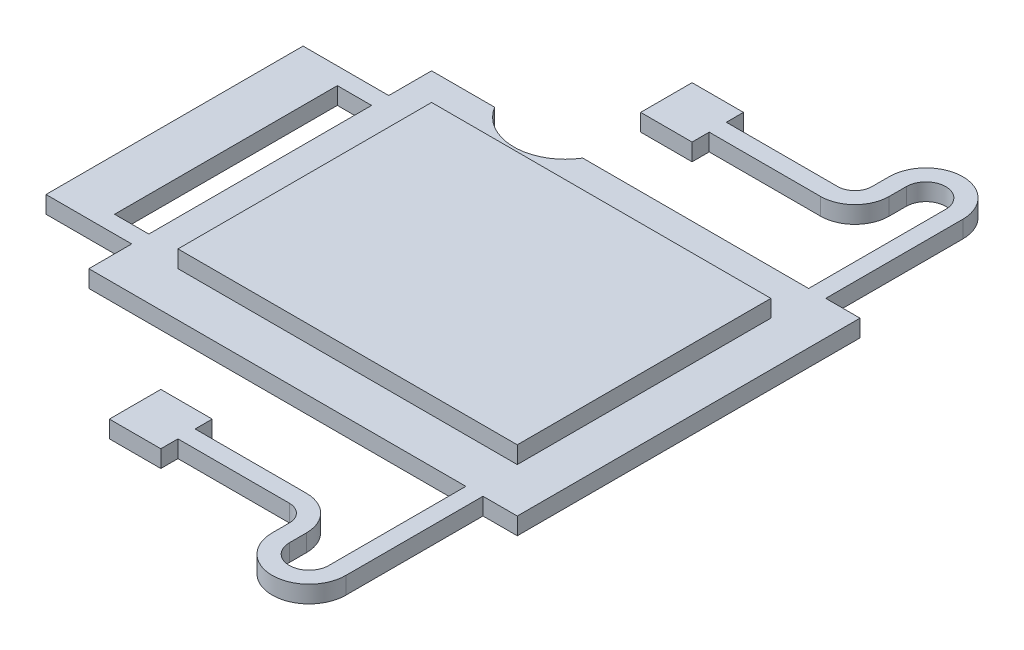
from build123d import *

# Parameters (mm, degrees)
SKETCH_1_W          = 25
SKETCH_1_H          = 20
EXTRUDE_1_DEPTH     = 1
EXTRUDE_2_DEPTH     = 1
EXTRUDE_3_DEPTH     = 1
SKETCH_5_W          = 19.8
SKETCH_5_H          = 14.8
EXTRUDE_4_DEPTH     = 1
SKETCH_6_R          = 2
CUT_EXTRUDE_2_DEPTH = 1.6
SKETCH_7_R          = 3
CUT_EXTRUDE_3_DEPTH = 1


with BuildPart() as part:
    # Эскиз1 → Бобышка-Вытянуть1 (new body)
    with BuildSketch(Plane(origin=(0, 0, 0), x_dir=(1, 0, 0), z_dir=(0, 1, 0))):
        Rectangle(SKETCH_1_W, SKETCH_1_H)
    extrude(amount=EXTRUDE_1_DEPTH)

    # Эскиз3 → Бобышка-Вытянуть2 (add)
    with BuildSketch(Plane(origin=(0, 0, 0), x_dir=(1, 0, 0), z_dir=(0, 1, 0))):
        Polygon((-14.5, 7.5), (-17.5, 7.5), (-17.5, -7.5), (-14.5, -7.5), (-12.5, -7.5), (-12.5, -6.5), (-14.5, -6.5), (-14.5, 6.5), (-12.5, 6.5), (-12.5, 7.5), align=None)
    extrude(amount=EXTRUDE_2_DEPTH)

    # Эскиз4 → Бобышка-Вытянуть3 (add)
    with BuildSketch(Plane(origin=(0, 0, 0), x_dir=(1, 0, 0), z_dir=(0, 1, 0))):
        with BuildLine():
            Line((9.5, 10), (9.5, 18))
            ThreePointArc((9.5, 18), (8.35, 19.15), (7.2, 18))
            Line((7.2, 18), (7.2, 17))
            ThreePointArc((7.2, 17), (6.614213562, 15.585786438), (5.2, 15))
            Line((5.2, 15), (-1.3, 15))
            Line((-1.3, 15), (-1.3, 14))
            Line((-1.3, 14), (-4.3, 14))
            Line((-4.3, 14), (-4.3, 17))
            Line((-4.3, 17), (-1.3, 17))
            Line((-1.3, 17), (-1.3, 16))
            Line((-1.3, 16), (5.2, 16))
            ThreePointArc((5.2, 16), (5.907106781, 16.292893219), (6.2, 17))
            Line((6.2, 17), (6.2, 18))
            ThreePointArc((6.2, 18), (8.35, 20.15), (10.5, 18))
            Line((10.5, 18), (10.5, 10))
            Line((10.5, 10), (9.5, 10))
        make_face()
        with BuildLine():
            Line((-4.3, -14), (-4.3, -17))
            Line((-4.3, -17), (-1.3, -17))
            Line((-1.3, -17), (-1.3, -16))
            Line((-1.3, -16), (5.2, -16))
            ThreePointArc((5.2, -16), (5.907106781, -16.292893219), (6.2, -17))
            Line((6.2, -17), (6.2, -18))
            ThreePointArc((6.2, -18), (8.35, -20.15), (10.5, -18))
            Line((10.5, -18), (10.5, -10))
            Line((10.5, -10), (9.5, -10))
            Line((9.5, -10), (9.5, -18))
            ThreePointArc((9.5, -18), (8.35, -19.15), (7.2, -18))
            Line((7.2, -18), (7.2, -17))
            ThreePointArc((7.2, -17), (6.614213562, -15.585786438), (5.2, -15))
            Line((5.2, -15), (-1.3, -15))
            Line((-1.3, -15), (-1.3, -14))
            Line((-1.3, -14), (-4.3, -14))
        make_face()
    extrude(amount=EXTRUDE_3_DEPTH)

    # Эскиз5 → Бобышка-Вытянуть4 (add)
    with BuildSketch(Plane(origin=(0, 1, 0), x_dir=(1, 0, 0), z_dir=(0, 1, 0))):
        Rectangle(SKETCH_5_W, SKETCH_5_H)
    extrude(amount=EXTRUDE_4_DEPTH)

    # Эскиз6 → Вырез-Вытянуть2 (cut)
    with BuildSketch(Plane.XZ):
        with Locations(Location((0, 0, 0), (0, 0, 270))):
            Circle(SKETCH_6_R)
    extrude(amount=-CUT_EXTRUDE_2_DEPTH, mode=Mode.SUBTRACT)

    # Эскиз7 → Вырез-Вытянуть3 (cut)
    with BuildSketch(Plane.XZ):
        with Locations((-6.25, -11.55)):
            Circle(SKETCH_7_R)
    extrude(amount=-CUT_EXTRUDE_3_DEPTH, mode=Mode.SUBTRACT)


solid = part.part
